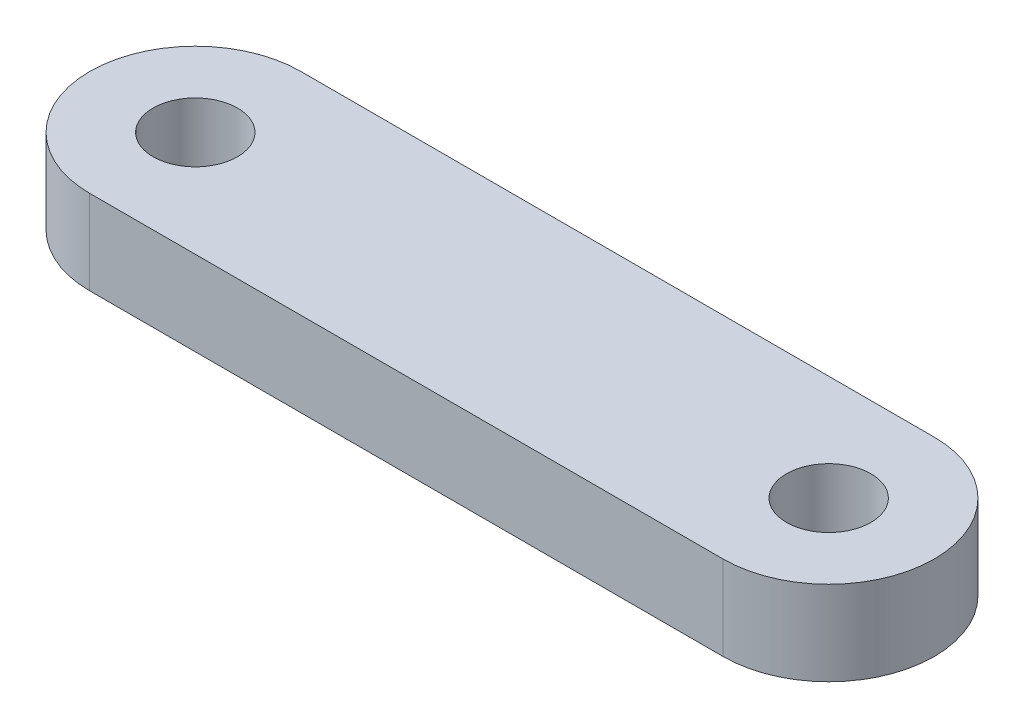
from build123d import *

# Parameters (mm, degrees)
SKETCH1_R           = 1
BOSS_EXTRUDE1_DEPTH = 2


with BuildPart() as part:
    # Sketch1 → Boss-Extrude1 (new body)
    with BuildSketch(Plane(origin=(0, 0, 0), x_dir=(1, 0, 0), z_dir=(0, 1, 0))):
        with BuildLine():
            Line((-10, 2.5), (5, 2.5))
            ThreePointArc((5, 2.5), (7.5, 0), (5, -2.5))
            Line((5, -2.5), (-10, -2.5))
            ThreePointArc((-10, -2.5), (-12.5, 0), (-10, 2.5))
        make_face()
        with Locations(Location((5, 0, 0), (0, 0, 270))):
            Circle(SKETCH1_R, mode=Mode.SUBTRACT)
        with Locations(Location((-10, 0, 0), (0, 0, 270))):
            Circle(SKETCH1_R, mode=Mode.SUBTRACT)
    extrude(amount=BOSS_EXTRUDE1_DEPTH)


solid = part.part
